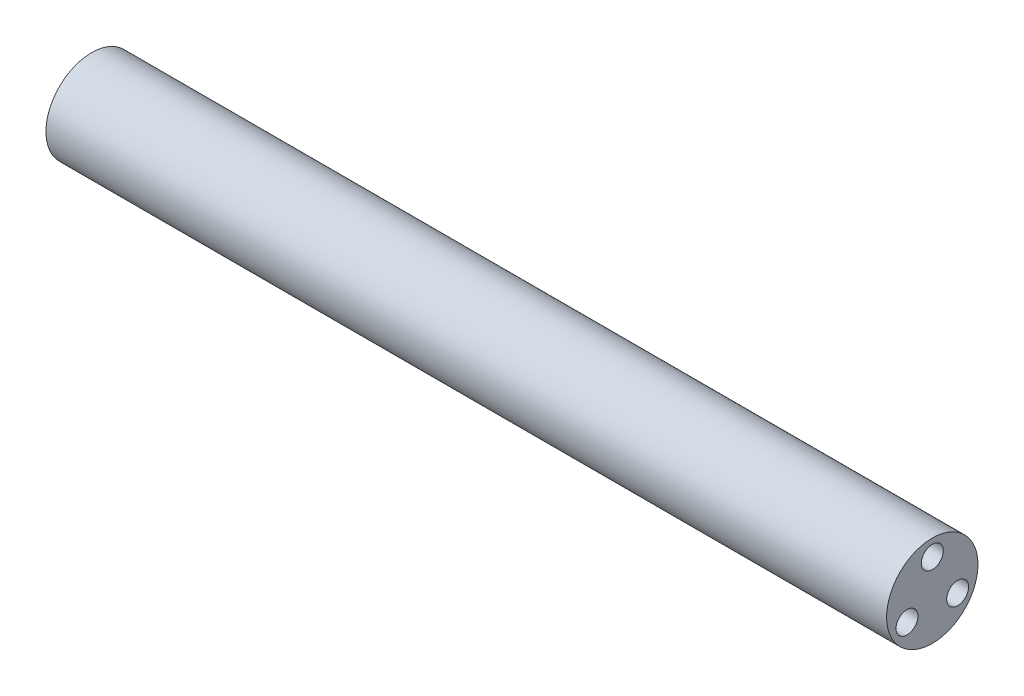
from build123d import *

# Parameters (mm, degrees)
SKETCH_1_R               = 12.5
EXTRUDE_1_DEPTH          = 230
SKETCH_2_R               = 3
CUT_EXTRUDE_1_DEPTH      = 20
PATTERN_CIRCULAR_1_COUNT = 3
MIRROR_1_COPY_1_SKETCH_R = 3
MIRROR_1_COPY_1_DEPTH    = 20
MIRROR_1_COPY_2_SKETCH_R = 3
MIRROR_1_COPY_2_DEPTH    = 20


with BuildPart() as part:
    # 草图1 → 凸台-拉伸1 (new body)
    with BuildSketch(Plane(origin=(0, 0, 0), x_dir=(0, 0, -1), z_dir=(1, 0, 0))):
        Circle(SKETCH_1_R)
    extrude(amount=EXTRUDE_1_DEPTH)

    # 草图2 → 切除-拉伸1 (cut)
    with BuildSketch(Plane(origin=(230, 0, 0), x_dir=(0, 0, -1), z_dir=(1, 0, 0))):
        with Locations((0, 8)):
            Circle(SKETCH_2_R)
    cut_extrude_1 = extrude(amount=-CUT_EXTRUDE_1_DEPTH, mode=Mode.SUBTRACT)

    # 阵列(圆周)1: 切除-拉伸1 ×3 about axis
    pattern_circular_1_axis = Axis((0, 0, 0), (1, 0, 0))
    for i in range(1, PATTERN_CIRCULAR_1_COUNT):
        add(cut_extrude_1.rotate(pattern_circular_1_axis, i * 360 / PATTERN_CIRCULAR_1_COUNT), mode=Mode.SUBTRACT)

    # 镜向1: 切除-拉伸1 across plane
    add(cut_extrude_1.mirror(Plane(origin=(115, 0, 0), x_dir=(0, 0, 1), z_dir=(1, 0, 0))), mode=Mode.SUBTRACT)

    # 镜向1 copy 1 sketch → 镜向1 copy 1 (cut)
    with BuildSketch(Plane(origin=(0, 0, 0), x_dir=(0, 0.8660254037844387, 0.4999999999999998), z_dir=(-1, 0, 0))):
        with Locations((0, -8)):
            Circle(MIRROR_1_COPY_1_SKETCH_R)
    extrude(amount=-MIRROR_1_COPY_1_DEPTH, mode=Mode.SUBTRACT)

    # 镜向1 copy 2 sketch → 镜向1 copy 2 (cut)
    with BuildSketch(Plane(origin=(0, 0, 0), x_dir=(0, -0.8660254037844384, 0.5000000000000004), z_dir=(-1, 0, 0))):
        with Locations((0, -8)):
            Circle(MIRROR_1_COPY_2_SKETCH_R)
    extrude(amount=-MIRROR_1_COPY_2_DEPTH, mode=Mode.SUBTRACT)


solid = part.part
